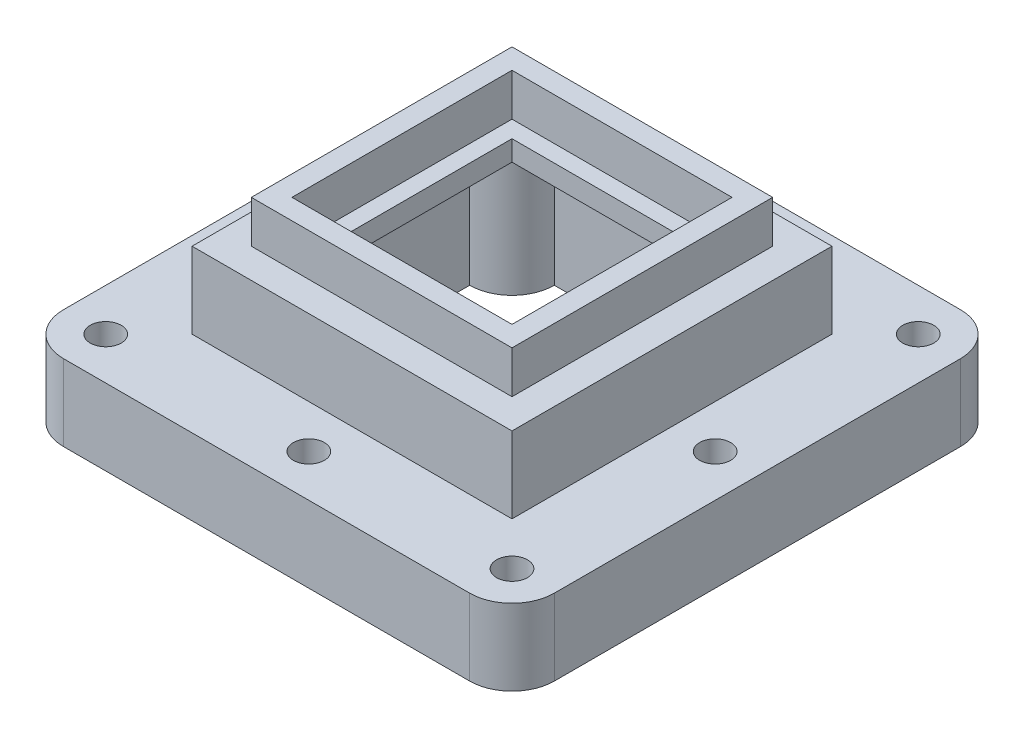
from build123d import *

# Parameters (mm, degrees)
SKETCH1_W            = 37.8
SKETCH1_H            = 37.8
SKETCH1_W_2          = 33
SKETCH1_H_2          = 33
BOSS_EXTRUDE1_DEPTH  = 9
BOSS_EXTRUDE8_START  = 9
SKETCH8_W            = 37.8
SKETCH8_H            = 37.8
SKETCH8_W_2          = 30.8
SKETCH8_H_2          = 30.8
SKETCH8_W_3          = 26
SKETCH8_H_3          = 26
SKETCH8_W_4          = 22
SKETCH8_H_4          = 22
BOSS_EXTRUDE8_DEPTH  = 2.4
BOSS_EXTRUDE9_START  = 9
SKETCH8_3_W          = 30.8
SKETCH8_3_H          = 30.8
SKETCH8_3_W_2        = 26
SKETCH8_3_H_2        = 26
BOSS_EXTRUDE9_DEPTH  = 5
SKETCH8_4_R          = 1.8288
SKETCH8_4_W          = 37.8
SKETCH8_4_H          = 37.8
BOSS_EXTRUDE10_DEPTH = 9
SKETCH8_5_R          = 1.8288
CUT_EXTRUDE3_DEPTH   = 44.33589736
LPATTERN2_COUNT      = 3
LPATTERN2_PITCH      = 24
LPATTERN2_COUNT_DIR2 = 3
LPATTERN2_PITCH_DIR2 = 24
BOSS_EXTRUDE11_DEPTH = 15.6
CIRPATTERN3_COUNT    = 4


with BuildPart() as part:
    # Sketch1 → Boss-Extrude1 (new, symmetric)
    with BuildSketch(Plane(origin=(0, 0, 0), x_dir=(1, 0, 0), z_dir=(0, 1, 0))):
        Rectangle(SKETCH1_W, SKETCH1_H)
        Rectangle(SKETCH1_W_2, SKETCH1_H_2, mode=Mode.SUBTRACT)
    extrude(amount=BOSS_EXTRUDE1_DEPTH, both=True)

    # Sketch8 → Boss-Extrude8 (add)
    # profile 1 of 3: a face of its own
    with BuildSketch(Plane(origin=(0, 0, 0), x_dir=(1, 0, 0), z_dir=(0, 1, 0)).offset(BOSS_EXTRUDE8_START)):
        Rectangle(SKETCH8_W, SKETCH8_H)
        Rectangle(SKETCH8_W_2, SKETCH8_H_2, mode=Mode.SUBTRACT)
    # profile 2 of 3: a face of its own
    with BuildSketch(Plane(origin=(0, 0, 0), x_dir=(1, 0, 0), z_dir=(0, 1, 0)).offset(BOSS_EXTRUDE8_START)):
        Rectangle(SKETCH8_W_2, SKETCH8_H_2)
        Rectangle(SKETCH8_W_3, SKETCH8_H_3, mode=Mode.SUBTRACT)
    # profile 3 of 3: a face of its own
    with BuildSketch(Plane(origin=(0, 0, 0), x_dir=(1, 0, 0), z_dir=(0, 1, 0)).offset(BOSS_EXTRUDE8_START)):
        Rectangle(SKETCH8_W_3, SKETCH8_H_3)
        Rectangle(SKETCH8_W_4, SKETCH8_H_4, mode=Mode.SUBTRACT)
    extrude(amount=-BOSS_EXTRUDE8_DEPTH)

    # Sketch8<3> → Boss-Extrude9 (add)
    with BuildSketch(Plane(origin=(0, 0, 0), x_dir=(1, 0, 0), z_dir=(0, 1, 0)).offset(BOSS_EXTRUDE9_START)):
        Rectangle(SKETCH8_3_W, SKETCH8_3_H)
        Rectangle(SKETCH8_3_W_2, SKETCH8_3_H_2, mode=Mode.SUBTRACT)
    extrude(amount=BOSS_EXTRUDE9_DEPTH)

    # Sketch8<4> → Boss-Extrude10 (add)
    # profile 1 of 2: a face of its own
    with BuildSketch(Plane(origin=(0, 0, 0), x_dir=(1, 0, 0), z_dir=(0, 1, 0))):
        with BuildLine():
            ThreePointArc((-29, 24), (-27.535533906, 27.535533906), (-24, 29))
            Line((-24, 29), (24, 29))
            ThreePointArc((24, 29), (27.535533906, 27.535533906), (29, 24))
            Line((29, 24), (29, -24))
            ThreePointArc((29, -24), (27.535533906, -27.535533906), (24, -29))
            Line((24, -29), (-24, -29))
            ThreePointArc((-24, -29), (-27.535533906, -27.535533906), (-29, -24))
            Line((-29, -24), (-29, 24))
        make_face()
        with Locations((-24, 24)):
            Circle(SKETCH8_4_R, mode=Mode.SUBTRACT)
        Rectangle(SKETCH8_4_W, SKETCH8_4_H, mode=Mode.SUBTRACT)
    # profile 2 of 2: a face of its own
    with BuildSketch(Plane(origin=(0, 0, 0), x_dir=(1, 0, 0), z_dir=(0, 1, 0))):
        with Locations((-24, 24)):
            Circle(SKETCH8_4_R)
    extrude(amount=-BOSS_EXTRUDE10_DEPTH)

    # Sketch8<5> → Cut-Extrude3 (cut, through all)
    with BuildSketch(Plane(origin=(0, 0, 0), x_dir=(1, 0, 0), z_dir=(0, 1, 0))):
        with Locations(Location((-24, 24, 0), (0, 0, 270))):
            Circle(SKETCH8_5_R)
    cut_extrude3 = extrude(amount=-CUT_EXTRUDE3_DEPTH, mode=Mode.SUBTRACT)

    # LPattern2: Cut-Extrude3 3 × 3
    with Locations(*[(i * LPATTERN2_PITCH, 0, j * LPATTERN2_PITCH_DIR2) for i in range(LPATTERN2_COUNT) for j in range(LPATTERN2_COUNT_DIR2) if (i, j) != (0, 0)]):
        add(cut_extrude3, mode=Mode.SUBTRACT)

    # Sketch10 → Boss-Extrude11 (add)
    with BuildSketch(Plane.XZ.offset(-6.6)):
        with BuildLine():
            Line((-16.5, -11.502376006), (-16.5, -16.5))
            Line((-16.5, -16.5), (-11.502376006, -16.5))
            ThreePointArc((-11.502376006, -16.5), (-12.966146184, -12.966146184), (-16.5, -11.502376006))
        make_face()
    boss_extrude11 = extrude(amount=BOSS_EXTRUDE11_DEPTH)

    # CirPattern3: Boss-Extrude11 ×4 about axis
    cirpattern3_axis = Axis((0, 0, 0), (0, 1, 0))
    for i in range(1, CIRPATTERN3_COUNT):
        add(boss_extrude11.rotate(cirpattern3_axis, i * 360 / CIRPATTERN3_COUNT))


solid = part.part
